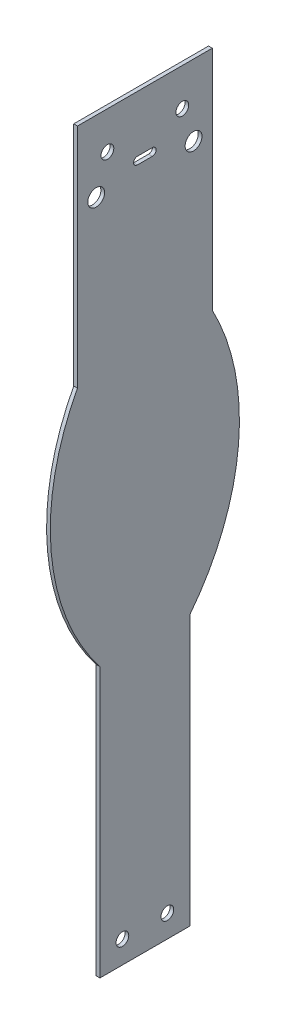
from build123d import *

# Parameters (mm, degrees)
BOSS_EXTRUDE1_DEPTH  = 1
M3_CLEARANCE_HOLE1_D = 3.4
M4_CLEARANCE_HOLE1_D = 4.5
CUT_EXTRUDE1_DEPTH   = 202.589376266
M3_CLEARANCE_HOLE2_D = 3.4


with BuildPart() as part:
    # Sketch1 → Boss-Extrude1 (new body)
    with BuildSketch(Plane(origin=(0, 0, 0), x_dir=(0, 0, -1), z_dir=(1, 0, 0))):
        with BuildLine():
            Line((12, -200), (12, -128))
            ThreePointArc((12, -128), (25, -95.198992339), (18, -60.617116977))
            Line((18, -60.617116977), (18, 0))
            Line((18, 0), (-18, 0))
            Line((-18, 0), (-18, -60.617116977))
            ThreePointArc((-18, -60.617116977), (-25, -95.198992339), (-12, -128))
            Line((-12, -128), (-12, -200))
            Line((-12, -200), (12, -200))
        make_face()
    extrude(amount=BOSS_EXTRUDE1_DEPTH)

    # M3 Clearance Hole1 (through all)
    with Locations(Plane.ZY):
        with Locations((10, -10), (-10, -10)):
            Hole(M3_CLEARANCE_HOLE1_D / 2)

    # M4 Clearance Hole1 (through all)
    with Locations(Plane.ZY):
        with Locations((-13, -19), (13, -19)):
            Hole(M4_CLEARANCE_HOLE1_D / 2)

    # Sketch10 → Cut-Extrude1 (cut, through all)
    with BuildSketch(Plane(origin=(1, 0, 0), x_dir=(0, 0, -1), z_dir=(1, 0, 0))):
        with BuildLine():
            Line((-2, -15), (2, -15))
            ThreePointArc((2, -15), (3, -16), (2, -17))
            Line((2, -17), (-2, -17))
            ThreePointArc((-2, -17), (-3, -16), (-2, -15))
        make_face()
    extrude(amount=-CUT_EXTRUDE1_DEPTH, mode=Mode.SUBTRACT)

    # M3 Clearance Hole2 (through all)
    with Locations(Plane(origin=(1, 0, 0), x_dir=(0, 0, -1), z_dir=(1, 0, 0))):
        with Locations((-6, -194), (6, -194)):
            Hole(M3_CLEARANCE_HOLE2_D / 2)


solid = part.part
